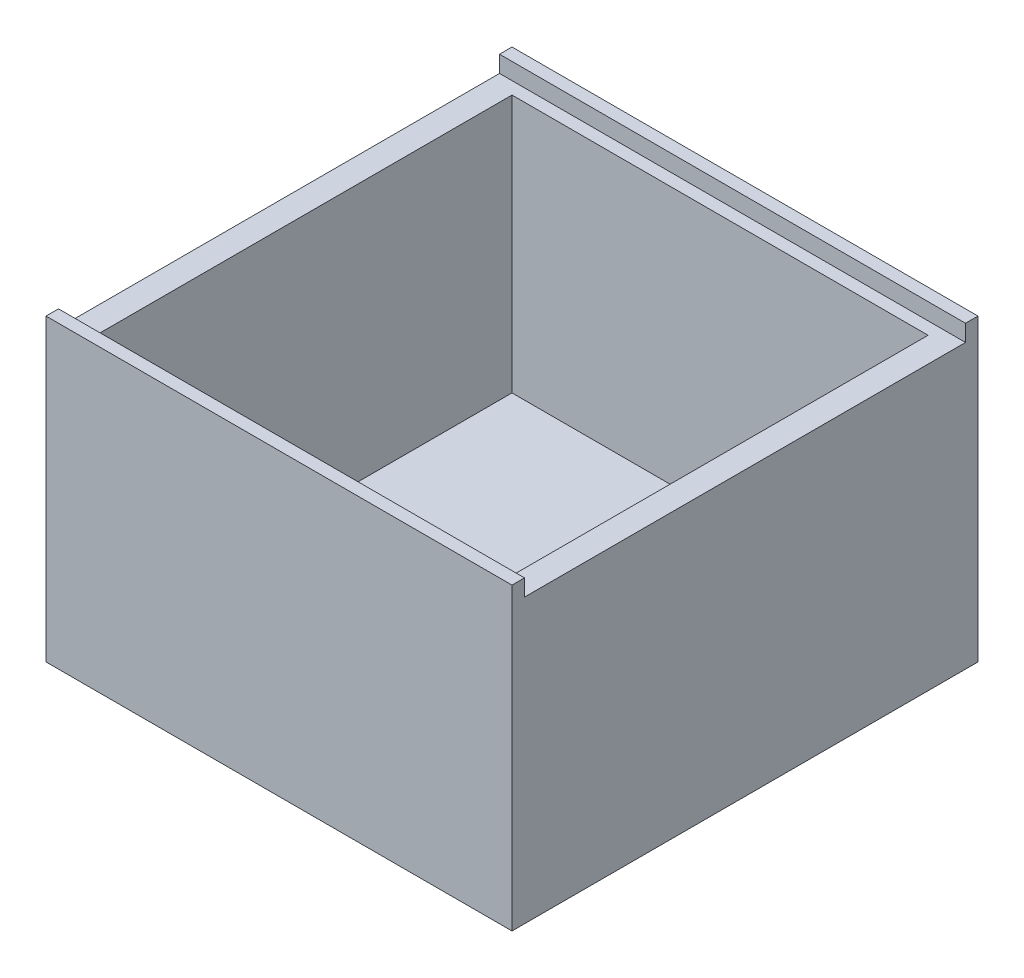
from build123d import *

# Parameters (mm, degrees)
SKETCH1_W           = 28
SKETCH1_H           = 28
BOSS_EXTRUDE1_DEPTH = 18
SHELL2_T            = -1.5
SKETCH2_W           = 26.5
SKETCH2_H           = 1
CUT_EXTRUDE1_DEPTH  = 37.110940171


with BuildPart() as part:
    # Sketch1 → Boss-Extrude1 (new body)
    with BuildSketch(Plane(origin=(0, 0, 0), x_dir=(1, 0, 0), z_dir=(0, 1, 0))):
        Rectangle(SKETCH1_W, SKETCH1_H)
    extrude(amount=BOSS_EXTRUDE1_DEPTH)

    # Shell2
    shell2_openings = [part.faces().sort_by_distance(p)[0] for p in [
        (0, 18, 0),
    ]]
    offset(amount=SHELL2_T, openings=shell2_openings, kind=Kind.INTERSECTION)

    # Sketch2 → Cut-Extrude1 (cut, through all)
    with BuildSketch(Plane.ZY.offset(14)):
        with Locations((0, 17.5)):
            Rectangle(SKETCH2_W, SKETCH2_H)
    extrude(amount=-CUT_EXTRUDE1_DEPTH, mode=Mode.SUBTRACT)


solid = part.part
